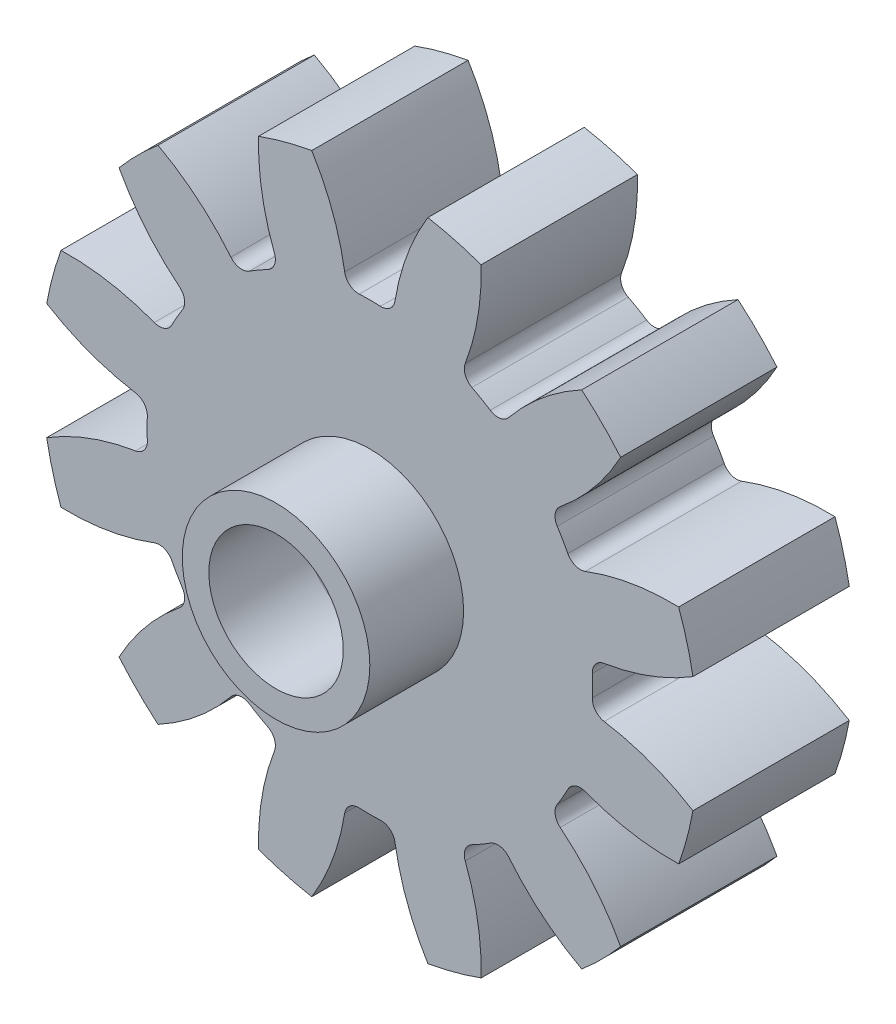
from build123d import *

# Parameters (mm, degrees)
SKETCH1_R                = 10.5
BOSS_EXTRUDE1_DEPTH      = 2.5
CUT_EXTRUDE1_DEPTH       = 16.058220346
FILLET1_R                = 0.45
CIRPATTERN1_COUNT        = 12
FILLET1_OF_CIRPATTERN1_R = 0.45
SKETCH3_R                = 3
SKETCH3_R_2              = 2.15
BOSS_EXTRUDE2_DEPTH      = 3
SKETCH8_R                = 2.161333762
CUT_EXTRUDE5_DEPTH       = 1


with BuildPart() as part:
    # Sketch1 → Boss-Extrude1 (new, symmetric)
    with BuildSketch(Plane.XY):
        Circle(SKETCH1_R)
    extrude(amount=BOSS_EXTRUDE1_DEPTH, both=True)

    # Sketch2 → Cut-Extrude1 (cut, symmetric)
    with BuildSketch(Plane.XY):
        with BuildLine():
            ThreePointArc((-2.49621045, 11.225815489), (-1.316774831, 9.284795282), (-0.749810724, 7.085436393))
            ThreePointArc((-0.749810724, 7.085436393), (0, 7.125), (0.749810724, 7.085436393))
            ThreePointArc((0.749810724, 7.085436393), (1.316774831, 9.284795282), (2.49621045, 11.225815489))
            ThreePointArc((2.49621045, 11.225815489), (0, 11.5), (-2.49621045, 11.225815489))
        make_face()
    cut_extrude1 = extrude(amount=CUT_EXTRUDE1_DEPTH, both=True, mode=Mode.SUBTRACT)

    # Fillet1
    fillet1_edges = [part.edges().sort_by_distance(p)[0] for p in [
        (-0.749810724, 7.085436393, 0),
        (0.749810724, 7.085436393, 0),
    ]]
    fillet(fillet1_edges, radius=FILLET1_R)

    # CirPattern1: Cut-Extrude1 ×12 about axis
    cirpattern1_axis = Axis((0, 0, 0), (0, 0, 1))
    for i in range(1, CIRPATTERN1_COUNT):
        add(cut_extrude1.rotate(cirpattern1_axis, i * 360 / CIRPATTERN1_COUNT), mode=Mode.SUBTRACT)

    # Fillet1 of CirPattern1
    fillet1_of_cirpattern1_edges = [part.edges().sort_by_distance(p)[0] for p in [
        (-4.192073332, 5.761262551, 0),
        (-2.893363061, 6.511073275, 0),
        (-6.511073275, 2.893363061, 0),
        (-5.761262551, 4.192073332, 0),
        (-7.085436393, -0.749810724, 0),
        (-7.085436393, 0.749810724, 0),
        (-5.761262551, -4.192073332, 0),
        (-6.511073275, -2.893363061, 0),
        (-2.893363061, -6.511073275, 0),
        (-4.192073332, -5.761262551, 0),
        (0.749810724, -7.085436393, 0),
        (-0.749810724, -7.085436393, 0),
        (4.192073332, -5.761262551, 0),
        (2.893363061, -6.511073275, 0),
        (6.511073275, -2.893363061, 0),
        (5.761262551, -4.192073332, 0),
        (7.085436393, 0.749810724, 0),
        (7.085436393, -0.749810724, 0),
        (5.761262551, 4.192073332, 0),
        (6.511073275, 2.893363061, 0),
        (2.893363061, 6.511073275, 0),
        (4.192073332, 5.761262551, 0),
    ]]
    fillet(fillet1_of_cirpattern1_edges, radius=FILLET1_OF_CIRPATTERN1_R)

    # Sketch3 → Boss-Extrude2 (add)
    with BuildSketch(Plane.XY.offset(2.5)):
        Circle(SKETCH3_R)
        Circle(SKETCH3_R_2, mode=Mode.SUBTRACT)
    extrude(amount=BOSS_EXTRUDE2_DEPTH)

    # Sketch8 → Cut-Extrude5 (cut)
    with BuildSketch(Plane.XY.offset(2.5)):
        with Locations((0.006065346, 0.009574222)):
            Circle(SKETCH8_R)
    extrude(amount=-CUT_EXTRUDE5_DEPTH, mode=Mode.SUBTRACT)


solid = part.part
